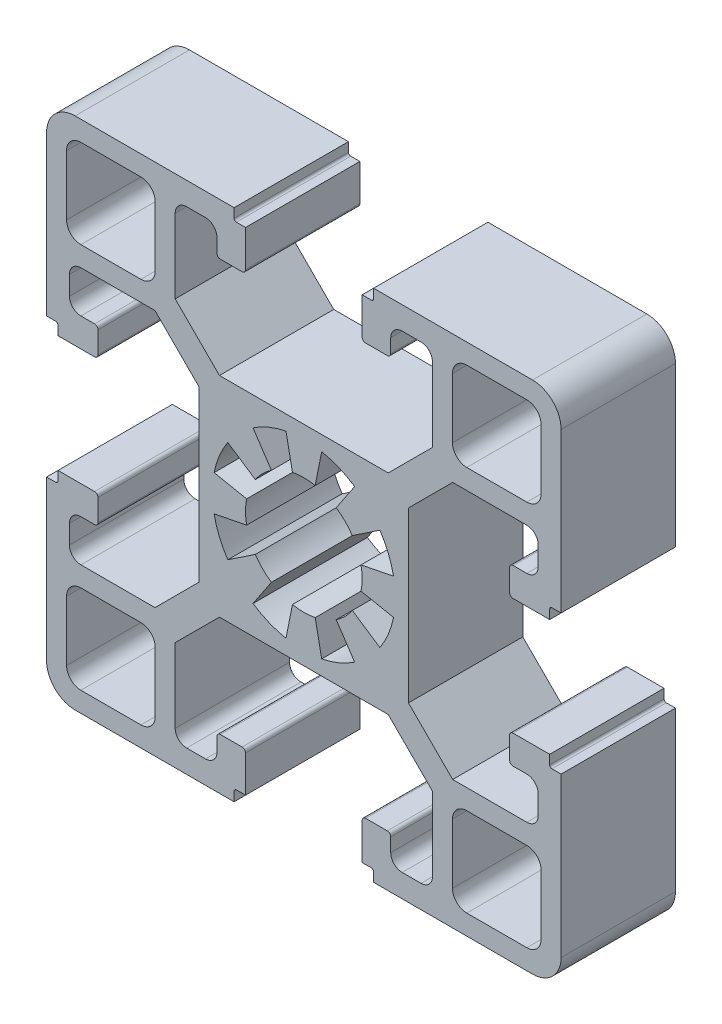
from build123d import *

# Parameters (mm, degrees)
EXTRUDE_1_DEPTH = 10


with BuildPart() as part:
    # 草图1 → 凸台-拉伸1 (new body)
    with BuildSketch(Plane.XY):
        with BuildLine():
            Line((-29.075744266, 38.982049519), (-42.975744266, 38.982049519))
            ThreePointArc((-42.975744266, 38.982049519), (-44.743511219, 38.249816472), (-45.475744266, 36.482049519))
            Line((-45.475744266, 36.482049519), (-45.475744266, 22.582049519))
            Line((-45.475744266, 22.582049519), (-44.675744266, 22.582049519))
            ThreePointArc((-44.675744266, 22.582049519), (-44.534322909, 22.523470875), (-44.475744266, 22.382049519))
            Line((-44.475744266, 22.382049519), (-44.475744266, 21.582049519))
            Line((-44.475744266, 21.582049519), (-41.275744266, 21.582049519))
            ThreePointArc((-41.275744266, 21.582049519), (-41.063612231, 21.669917484), (-40.975744266, 21.882049519))
            Line((-40.975744266, 21.882049519), (-40.975744266, 23.782049519))
            ThreePointArc((-40.975744266, 23.782049519), (-41.063612231, 23.994181553), (-41.275744266, 24.082049519))
            Line((-41.275744266, 24.082049519), (-42.475744266, 24.082049519))
            ThreePointArc((-42.475744266, 24.082049519), (-43.182851047, 24.374942737), (-43.475744266, 25.082049519))
            Line((-43.475744266, 25.082049519), (-43.475744266, 26.732049519))
            ThreePointArc((-43.475744266, 26.732049519), (-43.182851047, 27.4391563), (-42.475744266, 27.732049519))
            Line((-42.475744266, 27.732049519), (-35.993511219, 27.732049519))
            Line((-35.993511219, 27.732049519), (-32.125744266, 23.864282566))
            Line((-32.125744266, 23.864282566), (-32.125744266, 9.099816472))
            Line((-32.125744266, 9.099816472), (-35.993511219, 5.232049519))
            Line((-35.993511219, 5.232049519), (-42.475744266, 5.232049519))
            ThreePointArc((-42.475744266, 5.232049519), (-43.182851047, 5.524942737), (-43.475744266, 6.232049519))
            Line((-43.475744266, 6.232049519), (-43.475744266, 7.882049519))
            ThreePointArc((-43.475744266, 7.882049519), (-43.182851047, 8.5891563), (-42.475744266, 8.882049519))
            Line((-42.475744266, 8.882049519), (-41.275744266, 8.882049519))
            ThreePointArc((-41.275744266, 8.882049519), (-41.063612231, 8.969917484), (-40.975744266, 9.182049519))
            Line((-40.975744266, 9.182049519), (-40.975744266, 11.082049519))
            ThreePointArc((-40.975744266, 11.082049519), (-41.063612231, 11.294181553), (-41.275744266, 11.382049519))
            Line((-41.275744266, 11.382049519), (-44.475744266, 11.382049519))
            Line((-44.475744266, 11.382049519), (-44.475744266, 10.582049519))
            ThreePointArc((-44.475744266, 10.582049519), (-44.534322909, 10.440628162), (-44.675744266, 10.382049519))
            Line((-44.675744266, 10.382049519), (-45.475744266, 10.382049519))
            Line((-45.475744266, 10.382049519), (-45.475744266, -3.517950481))
            ThreePointArc((-45.475744266, -3.517950481), (-44.743511219, -5.285717434), (-42.975744266, -6.017950481))
            Line((-42.975744266, -6.017950481), (-29.075744266, -6.017950481))
            Line((-29.075744266, -6.017950481), (-29.075744266, -5.217950481))
            ThreePointArc((-29.075744266, -5.217950481), (-29.017165622, -5.076529125), (-28.875744266, -5.017950481))
            Line((-28.875744266, -5.017950481), (-28.075744266, -5.017950481))
            Line((-28.075744266, -5.017950481), (-28.075744266, -1.817950481))
            ThreePointArc((-28.075744266, -1.817950481), (-28.163612231, -1.605818447), (-28.375744266, -1.517950481))
            Line((-28.375744266, -1.517950481), (-30.275744266, -1.517950481))
            ThreePointArc((-30.275744266, -1.517950481), (-30.4878763, -1.605818447), (-30.575744266, -1.817950481))
            Line((-30.575744266, -1.817950481), (-30.575744266, -3.017950481))
            ThreePointArc((-30.575744266, -3.017950481), (-30.868637484, -3.725057263), (-31.575744266, -4.017950481))
            Line((-31.575744266, -4.017950481), (-33.225744266, -4.017950481))
            ThreePointArc((-33.225744266, -4.017950481), (-33.932851047, -3.725057263), (-34.225744266, -3.017950481))
            Line((-34.225744266, -3.017950481), (-34.225744266, 3.464282566))
            Line((-34.225744266, 3.464282566), (-30.357977313, 7.332049519))
            Line((-30.357977313, 7.332049519), (-15.593511219, 7.332049519))
            Line((-15.593511219, 7.332049519), (-11.725744266, 3.464282566))
            Line((-11.725744266, 3.464282566), (-11.725744266, -3.017950481))
            ThreePointArc((-11.725744266, -3.017950481), (-12.018637484, -3.725057263), (-12.725744266, -4.017950481))
            Line((-12.725744266, -4.017950481), (-14.375744266, -4.017950481))
            ThreePointArc((-14.375744266, -4.017950481), (-15.082851047, -3.725057263), (-15.375744266, -3.017950481))
            Line((-15.375744266, -3.017950481), (-15.375744266, -1.817950481))
            ThreePointArc((-15.375744266, -1.817950481), (-15.463612231, -1.605818447), (-15.675744266, -1.517950481))
            Line((-15.675744266, -1.517950481), (-17.575744266, -1.517950481))
            ThreePointArc((-17.575744266, -1.517950481), (-17.7878763, -1.605818447), (-17.875744266, -1.817950481))
            Line((-17.875744266, -1.817950481), (-17.875744266, -5.017950481))
            Line((-17.875744266, -5.017950481), (-17.075744266, -5.017950481))
            ThreePointArc((-17.075744266, -5.017950481), (-16.934322909, -5.076529125), (-16.875744266, -5.217950481))
            Line((-16.875744266, -5.217950481), (-16.875744266, -6.017950481))
            Line((-16.875744266, -6.017950481), (-2.975744266, -6.017950481))
            ThreePointArc((-2.975744266, -6.017950481), (-1.207977313, -5.285717434), (-0.475744266, -3.517950481))
            Line((-0.475744266, -3.517950481), (-0.475744266, 10.382049519))
            Line((-0.475744266, 10.382049519), (-1.275744266, 10.382049519))
            ThreePointArc((-1.275744266, 10.382049519), (-1.417165622, 10.440628162), (-1.475744266, 10.582049519))
            Line((-1.475744266, 10.582049519), (-1.475744266, 11.382049519))
            Line((-1.475744266, 11.382049519), (-4.675744266, 11.382049519))
            ThreePointArc((-4.675744266, 11.382049519), (-4.8878763, 11.294181553), (-4.975744266, 11.082049519))
            Line((-4.975744266, 11.082049519), (-4.975744266, 9.182049519))
            ThreePointArc((-4.975744266, 9.182049519), (-4.8878763, 8.969917484), (-4.675744266, 8.882049519))
            Line((-4.675744266, 8.882049519), (-3.475744266, 8.882049519))
            ThreePointArc((-3.475744266, 8.882049519), (-2.768637484, 8.5891563), (-2.475744266, 7.882049519))
            Line((-2.475744266, 7.882049519), (-2.475744266, 6.232049519))
            ThreePointArc((-2.475744266, 6.232049519), (-2.768637484, 5.524942737), (-3.475744266, 5.232049519))
            Line((-3.475744266, 5.232049519), (-9.957977313, 5.232049519))
            Line((-9.957977313, 5.232049519), (-13.825744266, 9.099816472))
            Line((-13.825744266, 9.099816472), (-13.825744266, 23.864282566))
            Line((-13.825744266, 23.864282566), (-9.957977313, 27.732049519))
            Line((-9.957977313, 27.732049519), (-3.475744266, 27.732049519))
            ThreePointArc((-3.475744266, 27.732049519), (-2.768637484, 27.4391563), (-2.475744266, 26.732049519))
            Line((-2.475744266, 26.732049519), (-2.475744266, 25.082049519))
            ThreePointArc((-2.475744266, 25.082049519), (-2.768637484, 24.374942737), (-3.475744266, 24.082049519))
            Line((-3.475744266, 24.082049519), (-4.675744266, 24.082049519))
            ThreePointArc((-4.675744266, 24.082049519), (-4.8878763, 23.994181553), (-4.975744266, 23.782049519))
            Line((-4.975744266, 23.782049519), (-4.975744266, 21.882049519))
            ThreePointArc((-4.975744266, 21.882049519), (-4.8878763, 21.669917484), (-4.675744266, 21.582049519))
            Line((-4.675744266, 21.582049519), (-1.475744266, 21.582049519))
            Line((-1.475744266, 21.582049519), (-1.475744266, 22.382049519))
            ThreePointArc((-1.475744266, 22.382049519), (-1.417165622, 22.523470875), (-1.275744266, 22.582049519))
            Line((-1.275744266, 22.582049519), (-0.475744266, 22.582049519))
            Line((-0.475744266, 22.582049519), (-0.475744266, 36.482049519))
            ThreePointArc((-0.475744266, 36.482049519), (-1.207977313, 38.249816472), (-2.975744266, 38.982049519))
            Line((-2.975744266, 38.982049519), (-16.875744266, 38.982049519))
            Line((-16.875744266, 38.982049519), (-16.875744266, 38.182049519))
            ThreePointArc((-16.875744266, 38.182049519), (-16.934322909, 38.040628162), (-17.075744266, 37.982049519))
            Line((-17.075744266, 37.982049519), (-17.875744266, 37.982049519))
            Line((-17.875744266, 37.982049519), (-17.875744266, 34.782049519))
            ThreePointArc((-17.875744266, 34.782049519), (-17.7878763, 34.569917484), (-17.575744266, 34.482049519))
            Line((-17.575744266, 34.482049519), (-15.675744266, 34.482049519))
            ThreePointArc((-15.675744266, 34.482049519), (-15.463612231, 34.569917484), (-15.375744266, 34.782049519))
            Line((-15.375744266, 34.782049519), (-15.375744266, 35.982049519))
            ThreePointArc((-15.375744266, 35.982049519), (-15.082851047, 36.6891563), (-14.375744266, 36.982049519))
            Line((-14.375744266, 36.982049519), (-12.725744266, 36.982049519))
            ThreePointArc((-12.725744266, 36.982049519), (-12.018637484, 36.6891563), (-11.725744266, 35.982049519))
            Line((-11.725744266, 35.982049519), (-11.725744266, 29.499816472))
            Line((-11.725744266, 29.499816472), (-15.593511219, 25.632049519))
            Line((-15.593511219, 25.632049519), (-30.357977313, 25.632049519))
            Line((-30.357977313, 25.632049519), (-34.225744266, 29.499816472))
            Line((-34.225744266, 29.499816472), (-34.225744266, 35.982049519))
            ThreePointArc((-34.225744266, 35.982049519), (-33.932851047, 36.6891563), (-33.225744266, 36.982049519))
            Line((-33.225744266, 36.982049519), (-31.575744266, 36.982049519))
            ThreePointArc((-31.575744266, 36.982049519), (-30.868637484, 36.6891563), (-30.575744266, 35.982049519))
            Line((-30.575744266, 35.982049519), (-30.575744266, 34.782049519))
            ThreePointArc((-30.575744266, 34.782049519), (-30.4878763, 34.569917484), (-30.275744266, 34.482049519))
            Line((-30.275744266, 34.482049519), (-28.375744266, 34.482049519))
            ThreePointArc((-28.375744266, 34.482049519), (-28.163612231, 34.569917484), (-28.075744266, 34.782049519))
            Line((-28.075744266, 34.782049519), (-28.075744266, 37.982049519))
            Line((-28.075744266, 37.982049519), (-28.875744266, 37.982049519))
            ThreePointArc((-28.875744266, 37.982049519), (-29.017165622, 38.040628162), (-29.075744266, 38.182049519))
            Line((-29.075744266, 38.182049519), (-29.075744266, 38.982049519))
        make_face()
        with BuildLine():
            Line((-42.475744266, 29.482049519), (-37.225744266, 29.482049519))
            ThreePointArc((-37.225744266, 29.482049519), (-36.341860789, 29.848166042), (-35.975744266, 30.732049519))
            Line((-35.975744266, 30.732049519), (-35.975744266, 35.982049519))
            ThreePointArc((-35.975744266, 35.982049519), (-36.341860789, 36.865932995), (-37.225744266, 37.232049519))
            Line((-37.225744266, 37.232049519), (-42.475744266, 37.232049519))
            ThreePointArc((-42.475744266, 37.232049519), (-43.359627742, 36.865932995), (-43.725744266, 35.982049519))
            Line((-43.725744266, 35.982049519), (-43.725744266, 30.732049519))
            ThreePointArc((-43.725744266, 30.732049519), (-43.359627742, 29.848166042), (-42.475744266, 29.482049519))
        make_face(mode=Mode.SUBTRACT)
        with BuildLine():
            Line((-3.475744266, 29.482049519), (-8.725744266, 29.482049519))
            ThreePointArc((-8.725744266, 29.482049519), (-9.609627742, 29.848166042), (-9.975744266, 30.732049519))
            Line((-9.975744266, 30.732049519), (-9.975744266, 35.982049519))
            ThreePointArc((-9.975744266, 35.982049519), (-9.609627742, 36.865932995), (-8.725744266, 37.232049519))
            Line((-8.725744266, 37.232049519), (-3.475744266, 37.232049519))
            ThreePointArc((-3.475744266, 37.232049519), (-2.591860789, 36.865932995), (-2.225744266, 35.982049519))
            Line((-2.225744266, 35.982049519), (-2.225744266, 30.732049519))
            ThreePointArc((-2.225744266, 30.732049519), (-2.591860789, 29.848166042), (-3.475744266, 29.482049519))
        make_face(mode=Mode.SUBTRACT)
        with BuildLine():
            Line((-42.475744266, 3.482049519), (-37.225744266, 3.482049519))
            ThreePointArc((-37.225744266, 3.482049519), (-36.341860789, 3.115932995), (-35.975744266, 2.232049519))
            Line((-35.975744266, 2.232049519), (-35.975744266, -3.017950481))
            ThreePointArc((-35.975744266, -3.017950481), (-36.341860789, -3.901833958), (-37.225744266, -4.267950481))
            Line((-37.225744266, -4.267950481), (-42.475744266, -4.267950481))
            ThreePointArc((-42.475744266, -4.267950481), (-43.359627742, -3.901833958), (-43.725744266, -3.017950481))
            Line((-43.725744266, -3.017950481), (-43.725744266, 2.232049519))
            ThreePointArc((-43.725744266, 2.232049519), (-43.359627742, 3.115932995), (-42.475744266, 3.482049519))
        make_face(mode=Mode.SUBTRACT)
        with BuildLine():
            Line((-3.475744266, 3.482049519), (-8.725744266, 3.482049519))
            ThreePointArc((-8.725744266, 3.482049519), (-9.609627742, 3.115932995), (-9.975744266, 2.232049519))
            Line((-9.975744266, 2.232049519), (-9.975744266, -3.017950481))
            ThreePointArc((-9.975744266, -3.017950481), (-9.609627742, -3.901833958), (-8.725744266, -4.267950481))
            Line((-8.725744266, -4.267950481), (-3.475744266, -4.267950481))
            ThreePointArc((-3.475744266, -4.267950481), (-2.591860789, -3.901833958), (-2.225744266, -3.017950481))
            Line((-2.225744266, -3.017950481), (-2.225744266, 2.232049519))
            ThreePointArc((-2.225744266, 2.232049519), (-2.591860789, 3.115932995), (-3.475744266, 3.482049519))
        make_face(mode=Mode.SUBTRACT)
        with BuildLine():
            Line((-27.42030613, 9.83029262), (-25.809152454, 12.241554496))
            ThreePointArc((-25.809152454, 12.241554496), (-26.58198885, 12.875804935), (-27.216239288, 13.64864133))
            Line((-27.216239288, 13.64864133), (-29.627501164, 12.037487654))
            ThreePointArc((-29.627501164, 12.037487654), (-30.366780526, 13.42058206), (-30.822026509, 14.921326942))
            Line((-30.822026509, 14.921326942), (-27.977749196, 15.487088876))
            ThreePointArc((-27.977749196, 15.487088876), (-28.075744266, 16.482049519), (-27.977749196, 17.477010161))
            Line((-27.977749196, 17.477010161), (-30.822026509, 18.042772095))
            ThreePointArc((-30.822026509, 18.042772095), (-30.366780526, 19.543516977), (-29.627501164, 20.926611383))
            Line((-29.627501164, 20.926611383), (-27.216239288, 19.315457707))
            ThreePointArc((-27.216239288, 19.315457707), (-26.58198885, 20.088294103), (-25.809152454, 20.722544541))
            Line((-25.809152454, 20.722544541), (-27.42030613, 23.133806417))
            ThreePointArc((-27.42030613, 23.133806417), (-26.037211725, 23.873085779), (-24.536466842, 24.328331762))
            Line((-24.536466842, 24.328331762), (-23.970704908, 21.484054449))
            ThreePointArc((-23.970704908, 21.484054449), (-22.975744266, 21.582049519), (-21.980783623, 21.484054449))
            Line((-21.980783623, 21.484054449), (-21.415021689, 24.328331762))
            ThreePointArc((-21.415021689, 24.328331762), (-19.914276807, 23.873085779), (-18.531182401, 23.133806417))
            Line((-18.531182401, 23.133806417), (-20.142336077, 20.722544541))
            ThreePointArc((-20.142336077, 20.722544541), (-19.369499682, 20.088294103), (-18.735249243, 19.315457707))
            Line((-18.735249243, 19.315457707), (-16.323987367, 20.926611383))
            ThreePointArc((-16.323987367, 20.926611383), (-15.584708005, 19.543516977), (-15.129462022, 18.042772095))
            Line((-15.129462022, 18.042772095), (-17.973739336, 17.477010161))
            ThreePointArc((-17.973739336, 17.477010161), (-17.875744266, 16.482049519), (-17.973739336, 15.487088876))
            Line((-17.973739336, 15.487088876), (-15.129462022, 14.921326942))
            ThreePointArc((-15.129462022, 14.921326942), (-15.584708005, 13.42058206), (-16.323987367, 12.037487654))
            Line((-16.323987367, 12.037487654), (-18.735249243, 13.64864133))
            ThreePointArc((-18.735249243, 13.64864133), (-19.369499682, 12.875804935), (-20.142336077, 12.241554496))
            Line((-20.142336077, 12.241554496), (-18.531182401, 9.83029262))
            ThreePointArc((-18.531182401, 9.83029262), (-19.914276807, 9.091013258), (-21.415021689, 8.635767275))
            Line((-21.415021689, 8.635767275), (-21.980783623, 11.480044589))
            ThreePointArc((-21.980783623, 11.480044589), (-22.975744266, 11.382049519), (-23.970704908, 11.480044589))
            Line((-23.970704908, 11.480044589), (-24.536466842, 8.635767275))
            ThreePointArc((-24.536466842, 8.635767275), (-26.037211725, 9.091013258), (-27.42030613, 9.83029262))
        make_face(mode=Mode.SUBTRACT)
    extrude(amount=EXTRUDE_1_DEPTH)


solid = part.part
